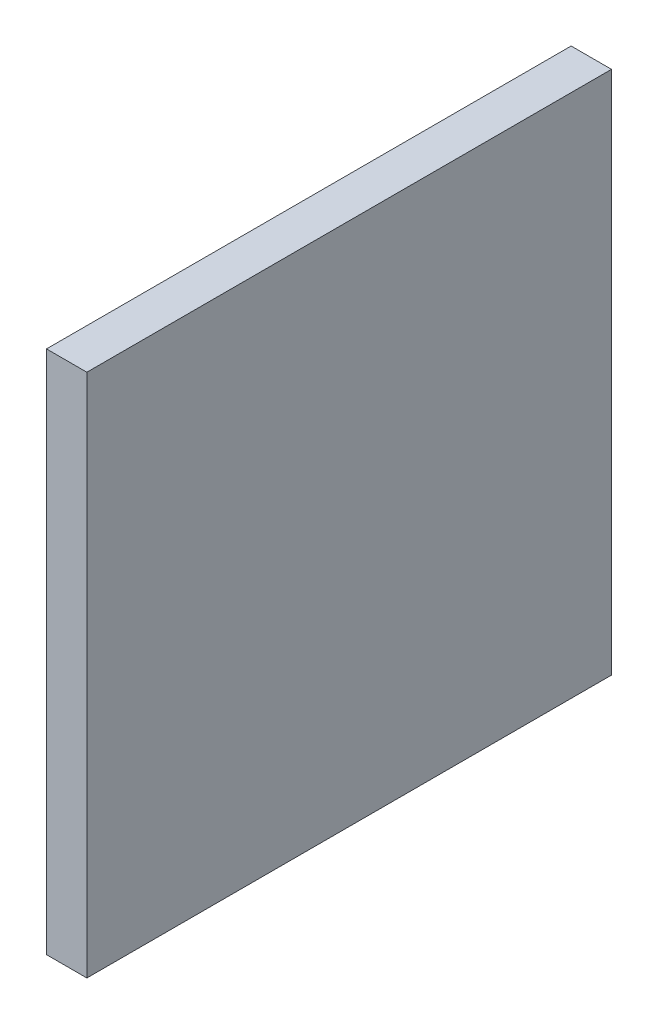
from build123d import *

# Parameters (mm, degrees)
CROQUIS1_W              = 165
CROQUIS1_H              = 165
SALIENTE_EXTRUIR1_DEPTH = 12.7


with BuildPart() as part:
    # Croquis1 → Saliente-Extruir1 (new body)
    with BuildSketch(Plane(origin=(0, 0, 0), x_dir=(0, 0, -1), z_dir=(1, 0, 0))):
        Rectangle(CROQUIS1_W, CROQUIS1_H)
    extrude(amount=SALIENTE_EXTRUIR1_DEPTH)


solid = part.part
